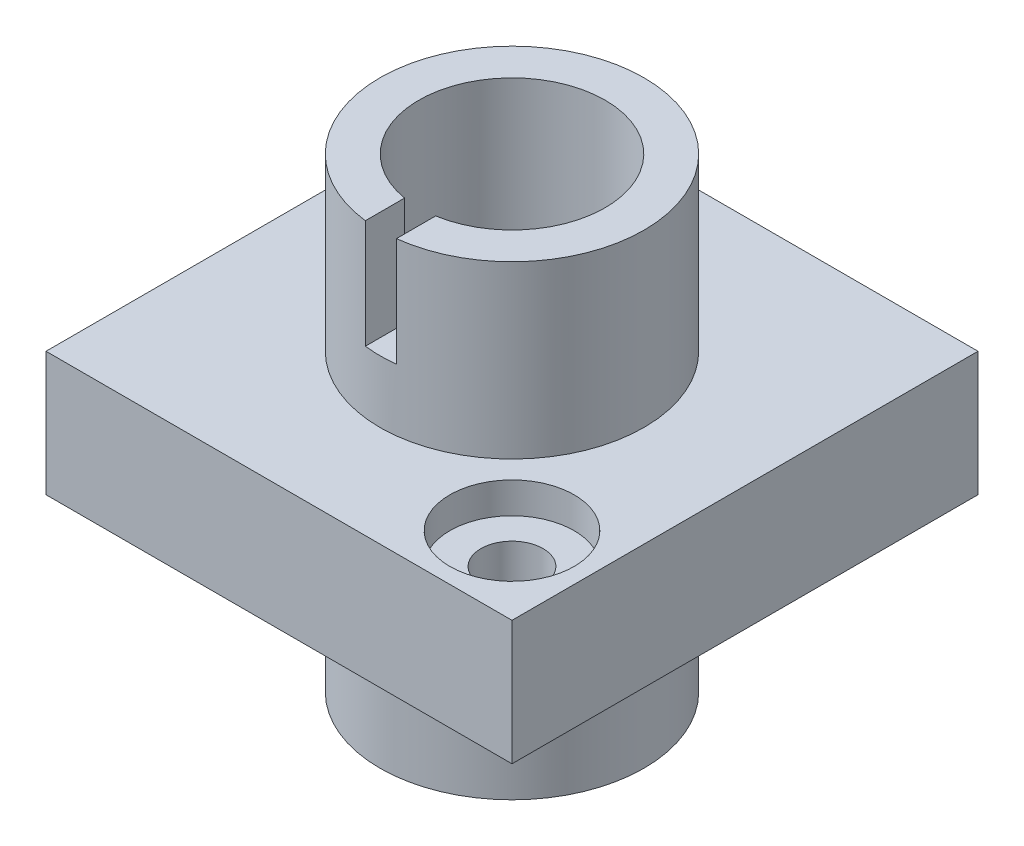
from build123d import *

# Parameters (mm, degrees)
SKETCH_1_W           = 15
SKETCH_1_H           = 15
EXTRUDE_1_DEPTH      = 4
EXTRUDE_2_DEPTH      = 5.5
EXTRUDE_2_DEPTH_BACK = 9.5
SKETCH_2_R           = 4.25
SKETCH_5_R           = 3
CUT_EXTRUDE_3_DEPTH  = 19.371173071
SKETCH_3_R           = 1
CUT_EXTRUDE_1_DEPTH  = 15.239030866
SKETCH_4_R           = 2
CUT_EXTRUDE_2_DEPTH  = 1
SKETCH_6_W           = 1
SKETCH_6_H           = 2.949438202
CUT_EXTRUDE_4_DEPTH  = 3.5


with BuildPart() as part:
    # 草图1 → 拉伸1 (new body)
    with BuildSketch(Plane(origin=(0, 0, 0), x_dir=(1, 0, 0), z_dir=(0, 1, 0))):
        Rectangle(SKETCH_1_W, SKETCH_1_H)
    extrude(amount=EXTRUDE_1_DEPTH)

    # 草图2 → 拉伸2 (add, two sides: drawn at the far end of the back side and taken through both)
    with BuildSketch(Plane(origin=(0, 4, 0), x_dir=(-1, 0, 0), z_dir=(0, 1, 0)).offset(-EXTRUDE_2_DEPTH_BACK)):
        with Locations(Location((0, 0, 0), (0, 0, 90))):
            Circle(SKETCH_2_R)
    extrude(amount=EXTRUDE_2_DEPTH + EXTRUDE_2_DEPTH_BACK)

    # 草图5 → 切除-拉伸3 (cut, through all)
    with BuildSketch(Plane.XZ.offset(5.5)):
        with Locations(Location((0, 0, 0), (0, 0, 270))):
            Circle(SKETCH_5_R)
    extrude(amount=-CUT_EXTRUDE_3_DEPTH, mode=Mode.SUBTRACT)

    # 草图3 → 切除-拉伸1 (cut, through all)
    with BuildSketch(Plane(origin=(0, 4, 0), x_dir=(-1, 0, 0), z_dir=(0, 1, 0))):
        with Locations(Location((5, -5, 0), (0, 0, 90))):
            Circle(SKETCH_3_R)
        with Locations(Location((-5, 5, 0), (0, 0, 90))):
            Circle(SKETCH_3_R)
    extrude(amount=-CUT_EXTRUDE_1_DEPTH, mode=Mode.SUBTRACT)

    # 草图4 → 切除-拉伸2 (cut)
    with BuildSketch(Plane(origin=(0, 4, 0), x_dir=(-1, 0, 0), z_dir=(0, 1, 0))):
        with Locations(Location((5, -5, 0), (0, 0, 90))):
            Circle(SKETCH_4_R)
        with Locations(Location((-5, 5, 0), (0, 0, 90))):
            Circle(SKETCH_4_R)
    extrude(amount=-CUT_EXTRUDE_2_DEPTH, mode=Mode.SUBTRACT)

    # 草图6 → 切除-拉伸4 (cut)
    with BuildSketch(Plane(origin=(0, 9.5, 0), x_dir=(-1, 0, 0), z_dir=(0, 1, 0))):
        with Locations((0, 3.651685393)):
            Rectangle(SKETCH_6_W, SKETCH_6_H)
    extrude(amount=-CUT_EXTRUDE_4_DEPTH, mode=Mode.SUBTRACT)


solid = part.part
